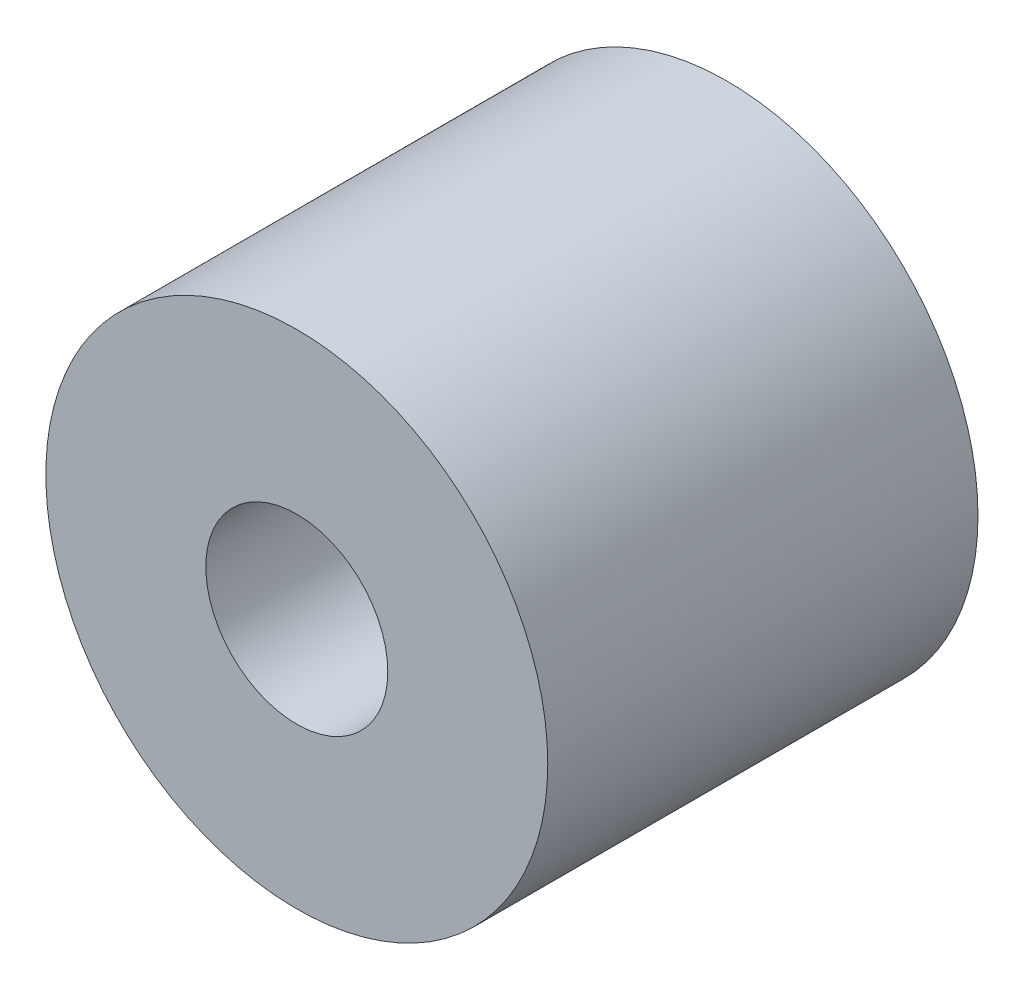
from build123d import *

# Parameters (mm, degrees)
SKETCH1_R           = 17.5
SKETCH1_R_2         = 6.345
BOSS_EXTRUDE1_DEPTH = 30


with BuildPart() as part:
    # Sketch1 → Boss-Extrude1 (new body)
    with BuildSketch(Plane.XY):
        Circle(SKETCH1_R)
        Circle(SKETCH1_R_2, mode=Mode.SUBTRACT)
    extrude(amount=BOSS_EXTRUDE1_DEPTH)


solid = part.part
